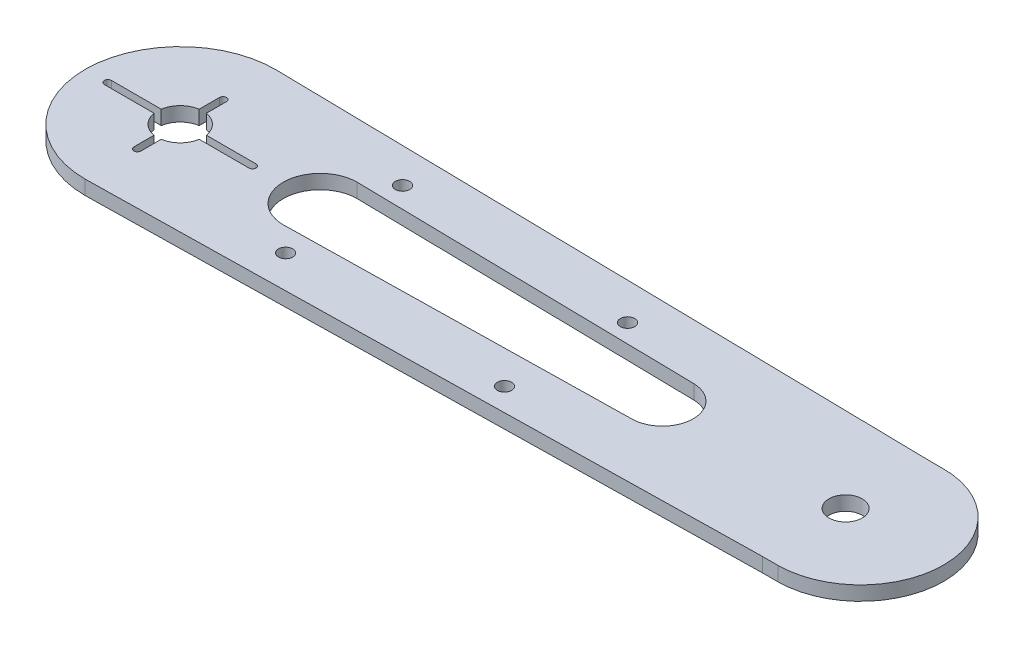
from build123d import *

# Parameters (mm, degrees)
BOSS_EXTRUDE1_DEPTH = 3
SKETCH2_R           = 4.8
SKETCH2_R_2         = 3.375
CUT_EXTRUDE1_DEPTH  = 159.793104384
CUT_EXTRUDE3_DEPTH  = 159.793104384
CUT_EXTRUDE4_DEPTH  = 159.793104384
SKETCH8_R           = 3.5
CUT_EXTRUDE6_DEPTH  = 159.793104384
SKETCH12_R          = 1.5
CUT_EXTRUDE8_DEPTH  = 10
BOSS_EXTRUDE2_START = -3
BOSS_EXTRUDE2_DEPTH = 3


with BuildPart() as part:
    # Sketch1 → Boss-Extrude1 (new body)
    with BuildSketch(Plane(origin=(0, 0, 0), x_dir=(1, 0, 0), z_dir=(0, 1, 0))):
        with BuildLine():
            Line((140.3125, 17.497209599), (0.357142857, 19.99681097))
            ThreePointArc((0.357142857, 19.99681097), (-19.999202727, 0.178578547), (0, -20))
            Line((0, -20), (140, -17.5))
            ThreePointArc((140, -17.5), (157.499302386, -0.156256229), (140.3125, 17.497209599))
        make_face()
    extrude(amount=BOSS_EXTRUDE1_DEPTH)

    # Sketch2 → Cut-Extrude1 (cut, through all)
    with BuildSketch(Plane(origin=(0, 3, 0), x_dir=(1, 0, 0), z_dir=(0, 1, 0))):
        with Locations(Location((0, 0, 0), (0, 0, 270))):
            Circle(SKETCH2_R)
        with Locations(Location((140, 0, 0), (0, 0, 270))):
            Circle(SKETCH2_R_2)
    extrude(amount=-CUT_EXTRUDE1_DEPTH, mode=Mode.SUBTRACT)

    # Sketch4 → Cut-Extrude3 (cut, through all)
    with BuildSketch(Plane(origin=(0, 3, 0), x_dir=(1, 0, 0), z_dir=(0, 1, 0))):
        with BuildLine():
            ThreePointArc((101.494647455, -6.185682468), (107.64017994, 0.394224207), (101.283865867, 6.770744637))
            Line((101.283865867, 6.770744637), (29.173044697, 8.058643229))
            ThreePointArc((29.173044697, 8.058643229), (21.397292905, 0.29833633), (29.157599804, -7.477415462))
            Line((29.157599804, -7.477415462), (101.052392136, -6.193579885))
            Line((101.052392136, -6.193579885), (101.494647455, -6.185682468))
        make_face()
    extrude(amount=-CUT_EXTRUDE3_DEPTH, mode=Mode.SUBTRACT)

    # Sketch6 → Cut-Extrude4 (cut, through all)
    with BuildSketch(Plane(origin=(0, 0, 0), x_dir=(1, 0, 0), z_dir=(0, 1, 0))):
        with BuildLine():
            Line((-15.22, 0.75), (15.22, 0.75))
            ThreePointArc((15.22, 0.75), (15.97, 0), (15.22, -0.75))
            Line((15.22, -0.75), (-15.22, -0.75))
            ThreePointArc((-15.22, -0.75), (-15.97, 0), (-15.22, 0.75))
        make_face()
        with BuildLine():
            Line((-0.75, -9), (-0.75, 9))
            ThreePointArc((-0.75, 9), (0, 9.75), (0.75, 9))
            Line((0.75, 9), (0.75, -9))
            ThreePointArc((0.75, -9), (0, -9.75), (-0.75, -9))
        make_face()
    extrude(amount=CUT_EXTRUDE4_DEPTH, mode=Mode.SUBTRACT)

    # Sketch8 → Cut-Extrude6 (cut, through all)
    with BuildSketch(Plane(origin=(0, 3, 0), x_dir=(1, 0, 0), z_dir=(0, 1, 0))):
        Circle(SKETCH8_R)
        with Locations(Location((140, 0, 0), (0, 0, 270))):
            Circle(SKETCH8_R)
    extrude(amount=-CUT_EXTRUDE6_DEPTH, mode=Mode.SUBTRACT)

    # Sketch12 → Cut-Extrude8 (cut)
    with BuildSketch(Plane(origin=(0, 3, 0), x_dir=(1, 0, 0), z_dir=(0, 1, 0))):
        with Locations(Location((83.194560065, 10.922443863, 0), (0, 0, 270))):
            Circle(SKETCH12_R)
        with Locations(Location((34.541656008, 12.231474735, 0), (0, 0, 270))):
            Circle(SKETCH12_R)
        with Locations(Location((34.541656008, -12.373276524, 0), (0, 0, 270))):
            Circle(SKETCH12_R)
        with Locations(Location((81.871511394, -13.646710106, 0), (0, 0, 270))):
            Circle(SKETCH12_R)
    extrude(amount=-CUT_EXTRUDE8_DEPTH, mode=Mode.SUBTRACT)

    # Sketch14 → Boss-Extrude2 (add)
    with BuildSketch(Plane(origin=(0, 3, 0), x_dir=(1, 0, 0), z_dir=(0, 1, 0)).offset(BOSS_EXTRUDE2_START)):
        with BuildLine():
            Line((140.3125, 17.497209599), (142.86969749, 17.497209599))
            ThreePointArc((142.86969749, 17.497209599), (160.632042581, 0.214901924), (143.301107477, -17.5))
            Line((143.301107477, -17.5), (140, -17.5))
            ThreePointArc((140, -17.5), (157.499302386, -0.156256229), (140.3125, 17.497209599))
        make_face()
    extrude(amount=BOSS_EXTRUDE2_DEPTH)


solid = part.part
